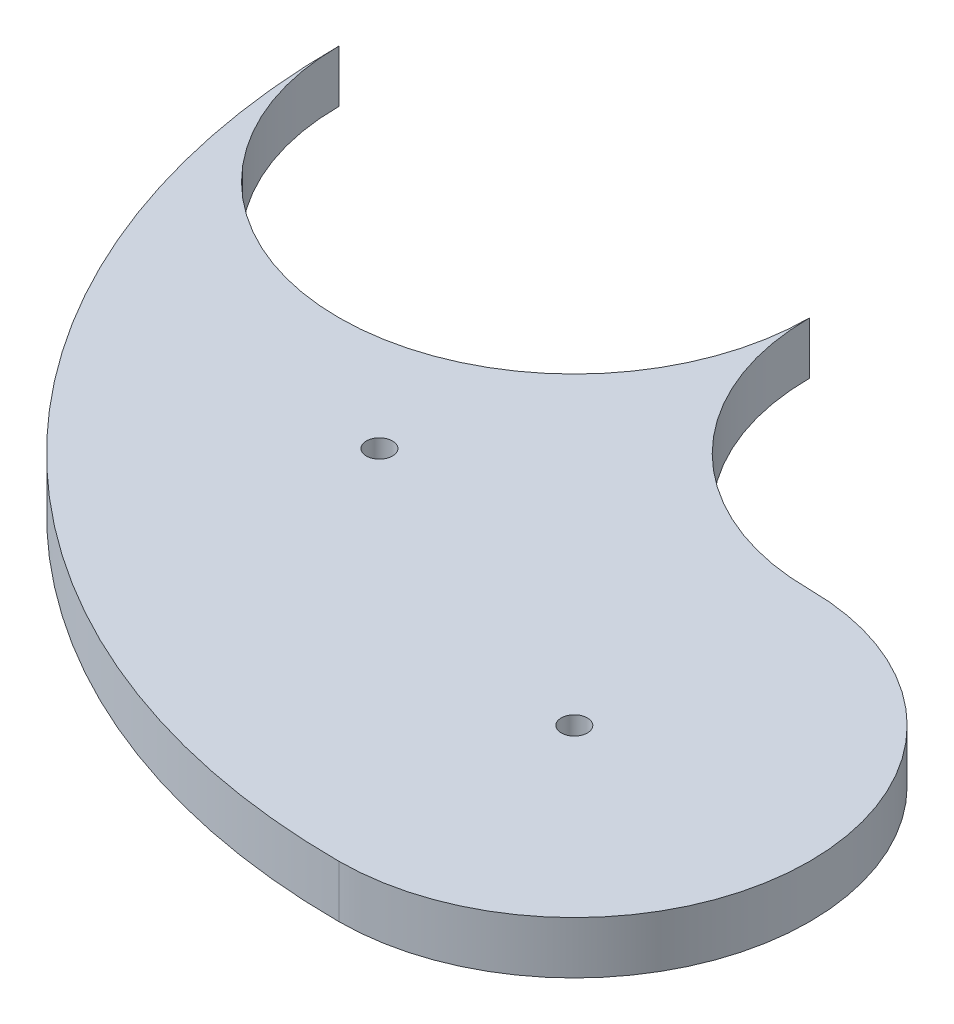
from build123d import *

# Parameters (mm, degrees)
EXTRUDE_1_DEPTH    = 5
HOLE_WIZARD_M3_1_D = 2.5


with BuildPart() as part:
    # 草圖1 → 填料-伸長1 (new body)
    with BuildSketch(Plane(origin=(0, 0, 0), x_dir=(1, 0, 0), z_dir=(0, 1, 0))):
        with BuildLine():
            ThreePointArc((-67.5, 45), (-47.72970773, -2.72970773), (0, -22.5))
            ThreePointArc((0, -22.5), (22.5, 0), (0, 22.5))
            ThreePointArc((0, 22.5), (-15.909902577, 29.090097423), (-22.5, 45))
            ThreePointArc((-22.5, 45), (-45, 22.5), (-67.5, 45))
        make_face()
    extrude(amount=-EXTRUDE_1_DEPTH)

    # M3 螺紋孔1 (through all)
    with Locations(Plane(origin=(0, 0, 0), x_dir=(1, 0, 0), z_dir=(0, 1, 0))):
        with Locations((-32.24496324, 13.611111111), (0, 0)):
            Hole(HOLE_WIZARD_M3_1_D / 2)


solid = part.part
